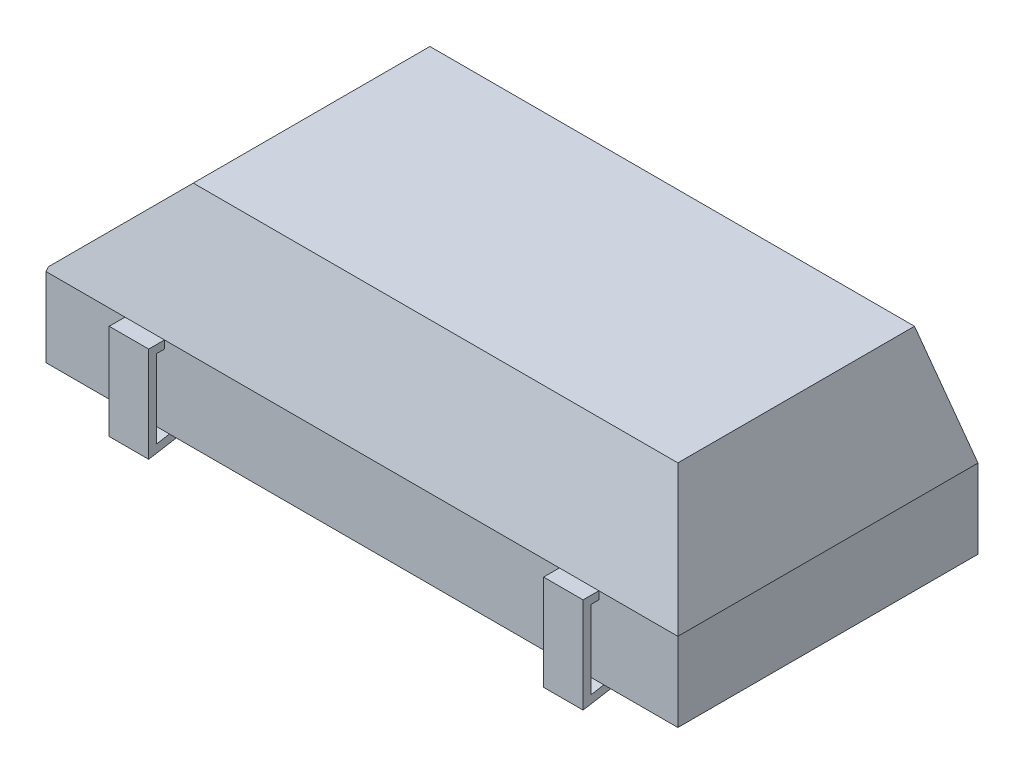
from build123d import *
from OCP.BRepFilletAPI import BRepFilletAPI_MakeChamfer

# Parameters (mm, degrees)
SKETCH1_W               = 8
SKETCH1_H               = 3.8
BOSS_EXTRUDE1_DEPTH     = 2.5
CHAMFER1_SIZE           = 1.5
CHAMFER1_SIZE2          = 0.401923789
CHAMFER2_SIZE           = 1.5
CHAMFER2_SIZE2          = 1.060660172
SKETCH2_W               = 0.5
SKETCH2_H               = 0.1
LPATTERN1_COUNT         = 2
LPATTERN1_PITCH         = 5.5
MIRROR1_COPY_1_SKETCH_W = 0.5
MIRROR1_COPY_1_SKETCH_H = 0.1
MIRROR1_COPY_2_SKETCH_W = 0.5
MIRROR1_COPY_2_SKETCH_H = 0.1


with BuildPart() as part:
    # Sketch1 → Boss-Extrude1 (new body)
    with BuildSketch(Plane(origin=(0, 0, 0), x_dir=(1, 0, 0), z_dir=(0, 1, 0))):
        Rectangle(SKETCH1_W, SKETCH1_H)
    extrude(amount=BOSS_EXTRUDE1_DEPTH)

    # Chamfer1: one chamfer whose edges measure the first distance from different faces: ONE call of the kernel's chamfer builder (chamfer() names one face for all edges)
    chamfer1_edges_1 = [part.edges().sort_by_distance(p)[0] for p in [
        (-4, 2.5, 0),
    ]]
    chamfer1_side_1 = [part.faces().sort_by_distance(p)[0] for p in [
        (-4, 1.25, 0),
    ]]
    chamfer1_edges_2 = [part.edges().sort_by_distance(p)[0] for p in [
        (0, 2.5, -1.9),
    ]]
    chamfer1_side_2 = [part.faces().sort_by_distance(p)[0] for p in [
        (0, 1.25, -1.9),
    ]]
    chamfer1_edges_3 = [part.edges().sort_by_distance(p)[0] for p in [
        (4, 2.5, 0),
    ]]
    chamfer1_side_3 = [part.faces().sort_by_distance(p)[0] for p in [
        (4, 1.25, 0),
    ]]
    chamfer1_edges_4 = [part.edges().sort_by_distance(p)[0] for p in [
        (0, 2.5, 1.9),
    ]]
    chamfer1_side_4 = [part.faces().sort_by_distance(p)[0] for p in [
        (0, 1.25, 1.9),
    ]]
    chamfer1 = BRepFilletAPI_MakeChamfer(part.part.solid().wrapped)
    for e in chamfer1_edges_1:
        chamfer1.Add(CHAMFER1_SIZE, CHAMFER1_SIZE2, e.wrapped, chamfer1_side_1[0].wrapped)  # the first distance lies on this face
    for e in chamfer1_edges_2:
        chamfer1.Add(CHAMFER1_SIZE, CHAMFER1_SIZE2, e.wrapped, chamfer1_side_2[0].wrapped)  # the first distance lies on this face
    for e in chamfer1_edges_3:
        chamfer1.Add(CHAMFER1_SIZE, CHAMFER1_SIZE2, e.wrapped, chamfer1_side_3[0].wrapped)  # the first distance lies on this face
    for e in chamfer1_edges_4:
        chamfer1.Add(CHAMFER1_SIZE, CHAMFER1_SIZE2, e.wrapped, chamfer1_side_4[0].wrapped)  # the first distance lies on this face
    add(Compound.cast(chamfer1.Shape()), mode=Mode.REPLACE)

    # Chamfer2
    chamfer2_edges = [part.edges().sort_by_distance(p)[0] for p in [
        (-3.598076211, 2.5, 0),
    ]]
    chamfer2_side = [part.faces().sort_by_distance(p)[0] for p in [
        (-3.80696135, 1.720430049, 0),
    ]]
    chamfer(chamfer2_edges, length=CHAMFER2_SIZE, length2=CHAMFER2_SIZE2, reference=chamfer2_side[0])

    # Sweep1: sweep along a path in Sketch3
    with BuildLine(Plane(origin=(-2.75, 0, 0), x_dir=(0, 0, -1), z_dir=(1, 0, 0))) as sweep1_path:
        Line((-1.9, 0.949951684), (-2.05, 0.949951684))
        Line((-2.05, 0.949951684), (-2.05, -0.150048316))
        Line((-2.05, -0.150048316), (-1.162596201, 0))
    # Sketch2 → Sweep1 (sweep)
    with BuildSketch(Plane.XY.offset(1.9)):
        with Locations((-2.75, 0.949951684)):
            Rectangle(SKETCH2_W, SKETCH2_H)
    sweep1 = sweep(path=sweep1_path.line, transition=Transition.RIGHT)

    # LPattern1: Sweep1 ×2
    with Locations(*[(i * LPATTERN1_PITCH, 0, 0) for i in range(1, LPATTERN1_COUNT)]):
        add(sweep1)

    # Mirror1 copy 1: sweep along a path in Mirror1 copy 1 path
    with BuildLine(Plane(origin=(2.75, 0, 0), x_dir=(0, 0, 1), z_dir=(1, 0, 0))) as mirror1_copy_1_path:
        Line((-1.9, -0.949951684), (-2.05, -0.949951684))
        Line((-2.05, -0.949951684), (-2.05, 0.150048316))
        Line((-2.05, 0.150048316), (-1.162596201, 0))
    # Mirror1 copy 1 sketch → Mirror1 copy 1 (sweep)
    with BuildSketch(Plane(origin=(5.5, 0, -1.9), x_dir=(1, 0, 0), z_dir=(0, 0, -1))):
        with Locations((-2.75, -0.949951684)):
            Rectangle(MIRROR1_COPY_1_SKETCH_W, MIRROR1_COPY_1_SKETCH_H)
    sweep(path=mirror1_copy_1_path.line, transition=Transition.RIGHT)

    # Mirror1 copy 2: sweep along a path in Mirror1 copy 2 path
    with BuildLine(Plane(origin=(-2.75, 0, 0), x_dir=(0, 0, 1), z_dir=(1, 0, 0))) as mirror1_copy_2_path:
        Line((-1.9, -0.949951684), (-2.05, -0.949951684))
        Line((-2.05, -0.949951684), (-2.05, 0.150048316))
        Line((-2.05, 0.150048316), (-1.162596201, 0))
    # Mirror1 copy 2 sketch → Mirror1 copy 2 (sweep)
    with BuildSketch(Plane(origin=(0, 0, -1.9), x_dir=(1, 0, 0), z_dir=(0, 0, -1))):
        with Locations((-2.75, -0.949951684)):
            Rectangle(MIRROR1_COPY_2_SKETCH_W, MIRROR1_COPY_2_SKETCH_H)
    sweep(path=mirror1_copy_2_path.line, transition=Transition.RIGHT)


solid = part.part
